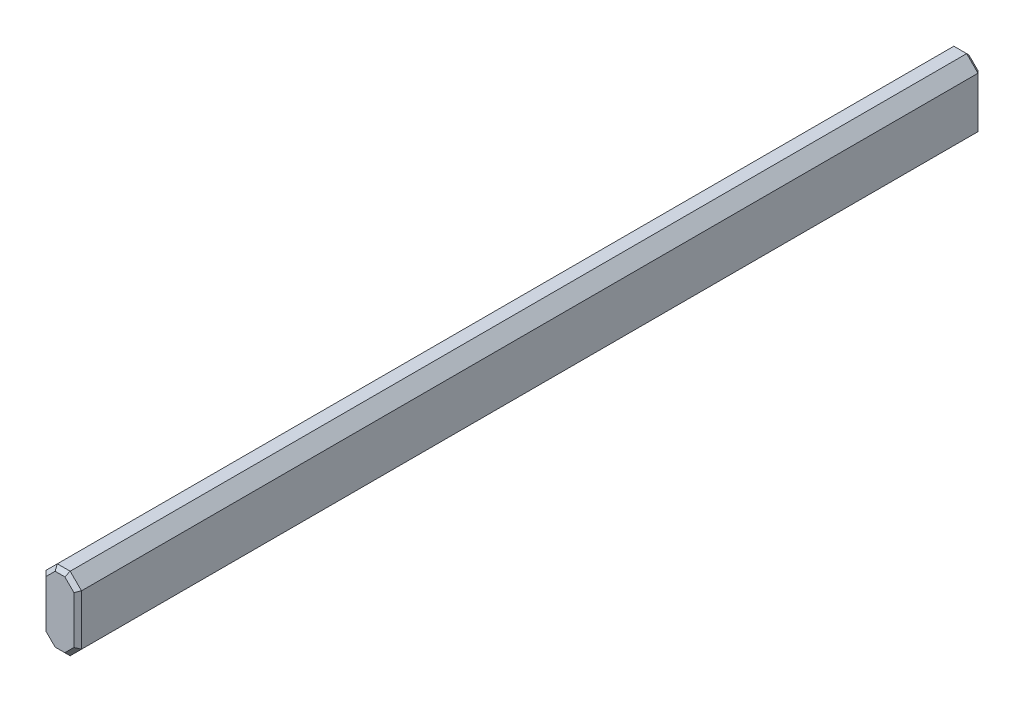
from build123d import *

# Parameters (mm, degrees)
ESBO_O2_W                = 4.7
ESBO_O2_H                = 9.7
RESSALTO_EXTRUS_O1_DEPTH = 119.7
CHANFRO1_SIZE            = 1.5
CHANFRO2_SIZE            = 0.5


with BuildPart() as part:
    # Esboço2 → Ressalto-extrusão1 (new body)
    with BuildSketch(Plane.XY):
        Rectangle(ESBO_O2_W, ESBO_O2_H)
    extrude(amount=RESSALTO_EXTRUS_O1_DEPTH)

    # Chanfro1
    chanfro1_edges = [part.edges().sort_by_distance(p)[0] for p in [
        (2.35, -4.85, 59.85),
        (-2.35, -4.85, 59.85),
        (-2.35, 4.85, 59.85),
        (2.35, 4.85, 59.85),
    ]]
    chamfer(chanfro1_edges, length=CHANFRO1_SIZE)

    # Chanfro2
    chanfro2_edges = [part.edges().sort_by_distance(p)[0] for p in [
        (0, -4.85, 0),
        (0, -4.85, 119.7),
        (2.35, 0, 0),
        (-2.35, 0, 0),
        (0, 4.85, 0),
        (1.6, 4.1, 0),
        (1.6, -4.1, 0),
        (-1.6, 4.1, 0),
        (-1.6, -4.1, 0),
        (-2.35, 0, 119.7),
        (2.35, 0, 119.7),
        (0, 4.85, 119.7),
        (1.6, 4.1, 119.7),
        (1.6, -4.1, 119.7),
        (-1.6, 4.1, 119.7),
        (-1.6, -4.1, 119.7),
    ]]
    chamfer(chanfro2_edges, length=CHANFRO2_SIZE)


solid = part.part
